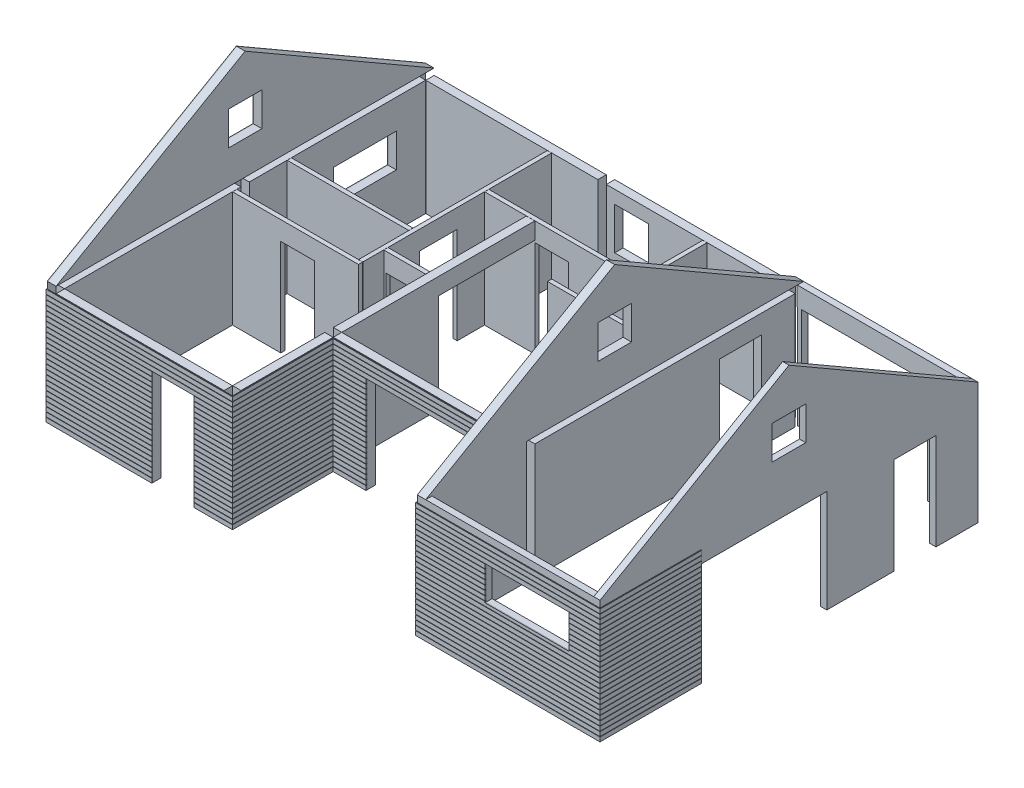
from build123d import *

# Parameters (mm, degrees)
SKETCH_1_W             = 200
SKETCH_1_H             = 797
EXTRUDE_3_DEPTH        = 2750
SKETCH_1_W_2           = 4097
SKETCH_1_H_2           = 200
EXTRUDE_3_2_DEPTH      = 2750
SKETCH_1_H_3           = 4200
EXTRUDE_3_3_DEPTH      = 2750
SKETCH_1_W_3           = 2297
EXTRUDE_3_4_DEPTH      = 2750
SKETCH_1_H_4           = 2194
EXTRUDE_3_5_DEPTH      = 2750
SKETCH_1_W_4           = 1200
EXTRUDE_3_6_DEPTH      = 2750
SKETCH_1_W_5           = 700
EXTRUDE_3_7_DEPTH      = 2750
SKETCH_1_W_6           = 1197
EXTRUDE_3_8_DEPTH      = 2750
SKETCH_1_H_5           = 4400
EXTRUDE_3_9_DEPTH      = 2750
SKETCH_1_H_6           = 2297
EXTRUDE_3_10_DEPTH     = 2750
EXTRUDE_3_11_DEPTH     = 2750
SKETCH_1_W_7           = 4300
EXTRUDE_3_12_DEPTH     = 2750
SKETCH_1_W_8           = 1051.560953437
SKETCH_1_H_7           = 100
EXTRUDE_3_13_DEPTH     = 2750
SKETCH_1_W_9           = 1145.439046563
EXTRUDE_3_14_DEPTH     = 2750
SKETCH_1_W_10          = 100
SKETCH_1_H_8           = 2247
EXTRUDE_3_15_DEPTH     = 2750
SKETCH_1_H_9           = 1347
EXTRUDE_3_16_DEPTH     = 2750
SKETCH_1_W_11          = 47
EXTRUDE_3_17_DEPTH     = 2750
SKETCH_1_W_12          = 2894
EXTRUDE_3_18_DEPTH     = 2750
SKETCH_1_W_13          = 1700
EXTRUDE_3_19_DEPTH     = 2750
SKETCH_1_W_14          = 2997
EXTRUDE_3_20_DEPTH     = 2750
SKETCH_1_H_10          = 1494
EXTRUDE_3_21_DEPTH     = 2750
EXTRUDE_3_22_DEPTH     = 2750
EXTRUDE_3_23_DEPTH     = 2750
SKETCH_2_W             = 1500
SKETCH_2_H             = 800
CUT_EXTRUDE_2_DEPTH    = 250
SKETCH_3_W             = 800
SKETCH_3_H             = 1000
CUT_EXTRUDE_3_DEPTH    = 593
SKETCH_4_W             = 933.030817478
SKETCH_4_H             = 100
SKETCH_4_W_2           = 947
SKETCH_4_W_3           = 100
SKETCH_4_H_2           = 1065.645919997
SKETCH_4_W_4           = 1106.288708332
SKETCH_4_W_5           = 2267.433140047
SKETCH_4_H_3           = 200
SKETCH_4_W_6           = 200
SKETCH_4_H_4           = 1253.150135291
SKETCH_4_W_7           = 1218.539312582
SKETCH_4_H_5           = 203
EXTRUDE_4_DEPTH        = 450
EXTRUDE_5_DEPTH        = 150
SKETCH_6_W             = 1000
SKETCH_6_H             = 2500
SKETCH_6_W_2           = 3000
SKETCH_6_H_2           = 2644.337567297
CUT_EXTRUDE_5_DEPTH    = 670
EXTRUDE_7_DEPTH        = 100
SKETCH_8_W             = 800
SKETCH_8_H             = 800
EXTRUDE_8_DEPTH        = 200
EXTRUDE_9_DEPTH        = 200
SKETCH_10_W            = 4000
SKETCH_10_H            = 150
SKETCH_10_W_2          = 900
SKETCH_10_W_3          = 100
EXTRUDE_10_DEPTH       = 3100
PATTERN_LINEAR_1_COUNT = 25
PATTERN_LINEAR_1_PITCH = 110
SKETCH_11_W            = 2397
SKETCH_11_H            = 2635.525513421
SKETCH_11_W_2          = 1000
SKETCH_11_H_2          = 2423.148146905
SKETCH_11_W_3          = 2000
SKETCH_11_H_3          = 800
CUT_EXTRUDE_6_DEPTH    = 5123
SKETCH_8_2_W           = 800
SKETCH_8_2_H           = 800
CUT_EXTRUDE_7_DEPTH    = 16606
SKETCH_13_W            = 800
SKETCH_13_H            = 800
SKETCH_13_W_2          = 1500
EXTRUDE_54769_DEPTH    = 10
SKETCH_14_W            = 4833.974306468
SKETCH_14_H            = 577.238350183
CUT_EXTRUDE_8_DEPTH    = 9961
SKETCH_16_W            = 150
SKETCH_16_H            = 455.662432703
EXTRUDE_16_DEPTH       = 4160
SKETCH_17_W            = 200
SKETCH_17_H            = 400
EXTRUDE_17_DEPTH       = 2297


with BuildPart() as part:
    # Эскиз1 → Бобышка-Вытянуть3 (new body)
    with BuildSketch(Plane(origin=(0, 0, 0), x_dir=(1, 0, 0), z_dir=(0, 1, 0))):
        with Locations((8900, -601.5)):
            Rectangle(SKETCH_1_W, SKETCH_1_H)
    extrude(amount=EXTRUDE_3_DEPTH)



with BuildPart() as body_2:
    # Эскиз1 → Extrude 3 2 (new body)
    with BuildSketch(Plane(origin=(0, 0, 0), x_dir=(1, 0, 0), z_dir=(0, 1, 0))):
        with Locations((2251.5, -100)):
            Rectangle(SKETCH_1_W_2, SKETCH_1_H_2)
    extrude(amount=EXTRUDE_3_2_DEPTH)


with BuildPart() as body_3:
    # Эскиз1 → Extrude 3 3 (new body)
    with BuildSketch(Plane(origin=(0, 0, 0), x_dir=(1, 0, 0), z_dir=(0, 1, 0))):
        with Locations((100, -2300)):
            Rectangle(SKETCH_1_W, SKETCH_1_H_3)
    extrude(amount=EXTRUDE_3_3_DEPTH)

    # Эскиз2 → Вырез-Вытянуть2 (cut)
    with BuildSketch(Plane.ZY):
        with Locations((1650, 1650)):
            Rectangle(SKETCH_2_W, SKETCH_2_H)
    extrude(amount=-CUT_EXTRUDE_2_DEPTH, mode=Mode.SUBTRACT)


with BuildPart() as body_4:
    # Эскиз1 → Extrude 3 4 (new body)
    with BuildSketch(Plane(origin=(0, 0, 0), x_dir=(1, 0, 0), z_dir=(0, 1, 0))):
        with Locations((1351.5, -8900)):
            Rectangle(SKETCH_1_W_3, SKETCH_1_H_2)
    extrude(amount=EXTRUDE_3_4_DEPTH)


with BuildPart() as body_5:
    # Эскиз1 → Extrude 3 5 (new body)
    with BuildSketch(Plane(origin=(0, 0, 0), x_dir=(1, 0, 0), z_dir=(0, 1, 0))):
        with Locations((4300, -7700)):
            Rectangle(SKETCH_1_W, SKETCH_1_H_4)
    extrude(amount=EXTRUDE_3_5_DEPTH)


with BuildPart() as body_6:
    # Эскиз1 → Extrude 3 6 (new body)
    with BuildSketch(Plane(origin=(0, 0, 0), x_dir=(1, 0, 0), z_dir=(0, 1, 0))):
        with Locations((8197, -6500)):
            Rectangle(SKETCH_1_W_4, SKETCH_1_H_2)
    extrude(amount=EXTRUDE_3_6_DEPTH)


with BuildPart() as body_7:
    # Эскиз1 → Extrude 3 7 (new body)
    with BuildSketch(Plane(origin=(0, 0, 0), x_dir=(1, 0, 0), z_dir=(0, 1, 0))):
        with Locations((3850, -8900)):
            Rectangle(SKETCH_1_W_5, SKETCH_1_H_2)
    extrude(amount=EXTRUDE_3_7_DEPTH)


with BuildPart() as body_8:
    # Эскиз1 → Extrude 3 8 (new body)
    with BuildSketch(Plane(origin=(0, 0, 0), x_dir=(1, 0, 0), z_dir=(0, 1, 0))):
        with Locations((4998.5, -6500)):
            Rectangle(SKETCH_1_W_6, SKETCH_1_H_2)
    extrude(amount=EXTRUDE_3_8_DEPTH)


with BuildPart() as body_9:
    # Эскиз1 → Extrude 3 9 (new body)
    with BuildSketch(Plane(origin=(0, 0, 0), x_dir=(1, 0, 0), z_dir=(0, 1, 0))):
        with Locations((8900, -4200)):
            Rectangle(SKETCH_1_W, SKETCH_1_H_5)
    extrude(amount=EXTRUDE_3_9_DEPTH)


with BuildPart() as body_10:
    # Эскиз1 → Extrude 3 10 (new body)
    with BuildSketch(Plane(origin=(0, 0, 0), x_dir=(1, 0, 0), z_dir=(0, 1, 0))):
        with Locations((4300, -5248.5)):
            Rectangle(SKETCH_1_W, SKETCH_1_H_6)
    extrude(amount=EXTRUDE_3_10_DEPTH)

    # Эскиз17 → Бобышка-Вытянуть17 (add)
    with BuildSketch(Plane(origin=(0, 0, 4100), x_dir=(-1, 0, 0), z_dir=(0, 0, -1))):
        with Locations((-4300, 2550)):
            Rectangle(SKETCH_17_W, SKETCH_17_H)
    extrude(amount=EXTRUDE_17_DEPTH)


with BuildPart() as body_11:
    # Эскиз1 → Extrude 3 11 (new body)
    with BuildSketch(Plane(origin=(0, 0, 0), x_dir=(1, 0, 0), z_dir=(0, 1, 0))):
        with Locations((100, -6700)):
            Rectangle(SKETCH_1_W, SKETCH_1_H_3)
    extrude(amount=EXTRUDE_3_11_DEPTH)


with BuildPart() as body_12:
    # Эскиз1 → Extrude 3 12 (new body)
    with BuildSketch(Plane(origin=(0, 0, 0), x_dir=(1, 0, 0), z_dir=(0, 1, 0))):
        with Locations((6650, -100)):
            Rectangle(SKETCH_1_W_7, SKETCH_1_H_2)
    extrude(amount=EXTRUDE_3_12_DEPTH)

    # Эскиз3 → Вырез-Вытянуть3 (cut)
    with BuildSketch(Plane(origin=(0, 0, 0), x_dir=(-1, 0, 0), z_dir=(0, 0, -1))):
        with Locations((-5100, 1940)):
            Rectangle(SKETCH_3_W, SKETCH_3_H)
    extrude(amount=-CUT_EXTRUDE_3_DEPTH, mode=Mode.SUBTRACT)


with BuildPart() as body_13:
    # Эскиз1 → Extrude 3 13 (new body)
    with BuildSketch(Plane(origin=(0, 0, 0), x_dir=(1, 0, 0), z_dir=(0, 1, 0))):
        with Locations((2674.219523282, -4750)):
            Rectangle(SKETCH_1_W_8, SKETCH_1_H_7)
    extrude(amount=EXTRUDE_3_13_DEPTH)


with BuildPart() as body_14:
    # Эскиз1 → Extrude 3 14 (new body)
    with BuildSketch(Plane(origin=(0, 0, 0), x_dir=(1, 0, 0), z_dir=(0, 1, 0))):
        with Locations((775.719523282, -4750)):
            Rectangle(SKETCH_1_W_9, SKETCH_1_H_7)
    extrude(amount=EXTRUDE_3_14_DEPTH)


with BuildPart() as body_15:
    # Эскиз1 → Extrude 3 15 (new body)
    with BuildSketch(Plane(origin=(0, 0, 0), x_dir=(1, 0, 0), z_dir=(0, 1, 0))):
        with Locations((3150, -1326.5)):
            Rectangle(SKETCH_1_W_10, SKETCH_1_H_8)
    extrude(amount=EXTRUDE_3_15_DEPTH)


with BuildPart() as body_16:
    # Эскиз1 → Extrude 3 16 (new body)
    with BuildSketch(Plane(origin=(0, 0, 0), x_dir=(1, 0, 0), z_dir=(0, 1, 0))):
        with Locations((3150, -4023.5)):
            Rectangle(SKETCH_1_W_10, SKETCH_1_H_9)
    extrude(amount=EXTRUDE_3_16_DEPTH)


with BuildPart() as body_17:
    # Эскиз1 → Extrude 3 17 (new body)
    with BuildSketch(Plane(origin=(0, 0, 0), x_dir=(1, 0, 0), z_dir=(0, 1, 0))):
        with Locations((4173.5, -4150)):
            Rectangle(SKETCH_1_W_11, SKETCH_1_H_7)
    extrude(amount=EXTRUDE_3_17_DEPTH)


with BuildPart() as body_18:
    # Эскиз1 → Extrude 3 18 (new body)
    with BuildSketch(Plane(origin=(0, 0, 0), x_dir=(1, 0, 0), z_dir=(0, 1, 0))):
        with Locations((1650, -3450)):
            Rectangle(SKETCH_1_W_12, SKETCH_1_H_7)
    extrude(amount=EXTRUDE_3_18_DEPTH)


with BuildPart() as body_19:
    # Эскиз1 → Extrude 3 19 (new body)
    with BuildSketch(Plane(origin=(0, 0, 0), x_dir=(1, 0, 0), z_dir=(0, 1, 0))):
        with Locations((6050, -1750)):
            Rectangle(SKETCH_1_W_13, SKETCH_1_H_7)
    extrude(amount=EXTRUDE_3_19_DEPTH)


with BuildPart() as body_20:
    # Эскиз1 → Extrude 3 20 (new body)
    with BuildSketch(Plane(origin=(0, 0, 0), x_dir=(1, 0, 0), z_dir=(0, 1, 0))):
        with Locations((7298.5, -2850)):
            Rectangle(SKETCH_1_W_14, SKETCH_1_H_7)
    extrude(amount=EXTRUDE_3_20_DEPTH)


with BuildPart() as body_21:
    # Эскиз1 → Extrude 3 21 (new body)
    with BuildSketch(Plane(origin=(0, 0, 0), x_dir=(1, 0, 0), z_dir=(0, 1, 0))):
        with Locations((6850, -950)):
            Rectangle(SKETCH_1_W_10, SKETCH_1_H_10)
    extrude(amount=EXTRUDE_3_21_DEPTH)


with BuildPart() as body_22:
    # Эскиз1 → Extrude 3 22 (new body)
    with BuildSketch(Plane(origin=(0, 0, 0), x_dir=(1, 0, 0), z_dir=(0, 1, 0))):
        with Locations((3801.5, -1750)):
            Rectangle(SKETCH_1_W_6, SKETCH_1_H_7)
    extrude(amount=EXTRUDE_3_22_DEPTH)


with BuildPart() as body_23:
    # Эскиз1 → Extrude 3 23 (new body)
    with BuildSketch(Plane(origin=(0, 0, 0), x_dir=(1, 0, 0), z_dir=(0, 1, 0))):
        with Locations((3226.5, -4150)):
            Rectangle(SKETCH_1_W_11, SKETCH_1_H_7)
    extrude(amount=EXTRUDE_3_23_DEPTH)


with BuildPart() as part_1:
    add(part.part)

    add(body_4.part)  # Бобышка-Вытянуть4 merges body 4

    add(body_6.part)  # Бобышка-Вытянуть4 merges body 6

    add(body_7.part)  # Бобышка-Вытянуть4 merges body 7

    add(body_8.part)  # Бобышка-Вытянуть4 merges body 8

    add(body_9.part)  # Бобышка-Вытянуть4 merges body 9

    add(body_13.part)  # Бобышка-Вытянуть4 merges body 13

    add(body_14.part)  # Бобышка-Вытянуть4 merges body 14

    add(body_15.part)  # Бобышка-Вытянуть4 merges body 15

    add(body_16.part)  # Бобышка-Вытянуть4 merges body 16

    add(body_17.part)  # Бобышка-Вытянуть4 merges body 17

    add(body_19.part)  # Бобышка-Вытянуть4 merges body 19

    add(body_22.part)  # Бобышка-Вытянуть4 merges body 22

    add(body_23.part)  # Бобышка-Вытянуть4 merges body 23
    # Эскиз4 → Бобышка-Вытянуть4 (add)
    with BuildSketch(Plane(origin=(0, 2750, 0), x_dir=(1, 0, 0), z_dir=(0, 1, 0))):
        with Locations((1765.152589037, -4750)):
            Rectangle(SKETCH_4_W, SKETCH_4_H)
        with Locations((3700, -4150)):
            Rectangle(SKETCH_4_W_2, SKETCH_4_H)
        with Locations((3150, -2862.337852944)):
            Rectangle(SKETCH_4_W_3, SKETCH_4_H_2)
        with Locations((4789.2288963, -1750)):
            Rectangle(SKETCH_4_W_4, SKETCH_4_H)
        with Locations((6556.719626978, -6500)):
            Rectangle(SKETCH_4_W_5, SKETCH_4_H_3)
        with Locations((8900, -1527.400889881)):
            Rectangle(SKETCH_4_W_6, SKETCH_4_H_4)
        with Locations((2988.285525283, -8898.5)):
            Rectangle(SKETCH_4_W_7, SKETCH_4_H_5)
    extrude(amount=-EXTRUDE_4_DEPTH)


with BuildPart() as body_11_2:
    # Эскиз5 → Бобышка-Вытянуть5 (new body)
    with BuildSketch(Plane(origin=(13000, 0, 0), x_dir=(0, 0, -1), z_dir=(1, 0, 0))):
        Polygon((-4500, 5498.076211353), (-9000, 2900), (-9000, -200), (0, -200), (0, 2900), align=None)
    extrude(amount=EXTRUDE_5_DEPTH)

    # Эскиз6 → Вырез-Вытянуть5 (cut)
    with BuildSketch(Plane(origin=(13000, 0, 0), x_dir=(0, 0, -1), z_dir=(1, 0, 0))):
        with Locations((-1500, 1050)):
            Rectangle(SKETCH_6_W, SKETCH_6_H)
        with Locations((-5100, 1122.168783649)):
            Rectangle(SKETCH_6_W_2, SKETCH_6_H_2)
    extrude(amount=CUT_EXTRUDE_5_DEPTH, mode=Mode.SUBTRACT)



with BuildPart() as body_12_2:
    # Эскиз7 → Бобышка-Вытянуть7 (new body)
    with BuildSketch(Plane(origin=(0, 0, 0), x_dir=(1, 0, 0), z_dir=(0, 1, 0))):
        Polygon((0, -4600), (0, -9000), (4400, -9000), (4400, -6603), (8800, -6600.066666667), (8800, -9000), (13150, -9000), (13150, -6600), (13170, -6600), (13170, -9020), (8780, -9020), (8780, -6620.080004444), (4420, -6622.986671111), (4420, -9020), (-20, -9020), (-20, -4600), align=None)
    extrude_7 = extrude(amount=EXTRUDE_7_DEPTH)


with BuildPart() as body_13_2:
    # Эскиз8 → Бобышка-Вытянуть8 (new body)
    with BuildSketch(Plane.ZY):
        Polygon((4500, 5498.076211353), (0, 2900), (9000, 2900), align=None)
        with Locations((4500, 4100)):
            Rectangle(SKETCH_8_W, SKETCH_8_H, mode=Mode.SUBTRACT)
    extrude(amount=-EXTRUDE_8_DEPTH)


with BuildPart() as body_14_2:
    # Эскиз9 → Бобышка-Вытянуть9 (new body)
    with BuildSketch(Plane(origin=(9000, 0, 0), x_dir=(0, 0, -1), z_dir=(1, 0, 0))):
        Polygon((-6600, -200), (-6600, 2900), (0, 2900), (-4500, 5498.076211353), (-9000, 2900), (-9000, -200), align=None)
    extrude(amount=-EXTRUDE_9_DEPTH)


with BuildPart() as body_11_2_1:
    add(body_11_2.part)

    add(body_14_2.part)  # Бобышка-Вытянуть10 merges body 14 2
    # Эскиз10 → Бобышка-Вытянуть10 (add)
    with BuildSketch(Plane.XZ.offset(200)):
        with Locations((11000, 8925)):
            Rectangle(SKETCH_10_W, SKETCH_10_H)
        with Locations((12550, 75)):
            Rectangle(SKETCH_10_W_2, SKETCH_10_H)
        with Locations((9050, 75)):
            Rectangle(SKETCH_10_W_3, SKETCH_10_H)
    extrude(amount=-EXTRUDE_10_DEPTH)


with BuildPart() as pattern_linear_1_1:
    # Линейный массив1: pattern copy
    add(extrude_7.moved(Location(Vector(0, 1, 0) * (1 * PATTERN_LINEAR_1_PITCH))))


with BuildPart() as pattern_linear_1_2:
    # Линейный массив1: pattern copy
    add(extrude_7.moved(Location(Vector(0, 1, 0) * (2 * PATTERN_LINEAR_1_PITCH))))


with BuildPart() as pattern_linear_1_3:
    # Линейный массив1: pattern copy
    add(extrude_7.moved(Location(Vector(0, 1, 0) * (3 * PATTERN_LINEAR_1_PITCH))))


with BuildPart() as pattern_linear_1_4:
    # Линейный массив1: pattern copy
    add(extrude_7.moved(Location(Vector(0, 1, 0) * (4 * PATTERN_LINEAR_1_PITCH))))


with BuildPart() as pattern_linear_1_5:
    # Линейный массив1: pattern copy
    add(extrude_7.moved(Location(Vector(0, 1, 0) * (5 * PATTERN_LINEAR_1_PITCH))))


with BuildPart() as pattern_linear_1_6:
    # Линейный массив1: pattern copy
    add(extrude_7.moved(Location(Vector(0, 1, 0) * (6 * PATTERN_LINEAR_1_PITCH))))


with BuildPart() as pattern_linear_1_7:
    # Линейный массив1: pattern copy
    add(extrude_7.moved(Location(Vector(0, 1, 0) * (7 * PATTERN_LINEAR_1_PITCH))))


with BuildPart() as pattern_linear_1_8:
    # Линейный массив1: pattern copy
    add(extrude_7.moved(Location(Vector(0, 1, 0) * (8 * PATTERN_LINEAR_1_PITCH))))


with BuildPart() as pattern_linear_1_9:
    # Линейный массив1: pattern copy
    add(extrude_7.moved(Location(Vector(0, 1, 0) * (9 * PATTERN_LINEAR_1_PITCH))))


with BuildPart() as pattern_linear_1_10:
    # Линейный массив1: pattern copy
    add(extrude_7.moved(Location(Vector(0, 1, 0) * (10 * PATTERN_LINEAR_1_PITCH))))


with BuildPart() as pattern_linear_1_11:
    # Линейный массив1: pattern copy
    add(extrude_7.moved(Location(Vector(0, 1, 0) * (11 * PATTERN_LINEAR_1_PITCH))))


with BuildPart() as pattern_linear_1_12:
    # Линейный массив1: pattern copy
    add(extrude_7.moved(Location(Vector(0, 1, 0) * (12 * PATTERN_LINEAR_1_PITCH))))


with BuildPart() as pattern_linear_1_13:
    # Линейный массив1: pattern copy
    add(extrude_7.moved(Location(Vector(0, 1, 0) * (13 * PATTERN_LINEAR_1_PITCH))))


with BuildPart() as pattern_linear_1_14:
    # Линейный массив1: pattern copy
    add(extrude_7.moved(Location(Vector(0, 1, 0) * (14 * PATTERN_LINEAR_1_PITCH))))


with BuildPart() as pattern_linear_1_15:
    # Линейный массив1: pattern copy
    add(extrude_7.moved(Location(Vector(0, 1, 0) * (15 * PATTERN_LINEAR_1_PITCH))))


with BuildPart() as pattern_linear_1_16:
    # Линейный массив1: pattern copy
    add(extrude_7.moved(Location(Vector(0, 1, 0) * (16 * PATTERN_LINEAR_1_PITCH))))


with BuildPart() as pattern_linear_1_17:
    # Линейный массив1: pattern copy
    add(extrude_7.moved(Location(Vector(0, 1, 0) * (17 * PATTERN_LINEAR_1_PITCH))))


with BuildPart() as pattern_linear_1_18:
    # Линейный массив1: pattern copy
    add(extrude_7.moved(Location(Vector(0, 1, 0) * (18 * PATTERN_LINEAR_1_PITCH))))


with BuildPart() as pattern_linear_1_19:
    # Линейный массив1: pattern copy
    add(extrude_7.moved(Location(Vector(0, 1, 0) * (19 * PATTERN_LINEAR_1_PITCH))))


with BuildPart() as pattern_linear_1_20:
    # Линейный массив1: pattern copy
    add(extrude_7.moved(Location(Vector(0, 1, 0) * (20 * PATTERN_LINEAR_1_PITCH))))


with BuildPart() as pattern_linear_1_21:
    # Линейный массив1: pattern copy
    add(extrude_7.moved(Location(Vector(0, 1, 0) * (21 * PATTERN_LINEAR_1_PITCH))))


with BuildPart() as pattern_linear_1_22:
    # Линейный массив1: pattern copy
    add(extrude_7.moved(Location(Vector(0, 1, 0) * (22 * PATTERN_LINEAR_1_PITCH))))


with BuildPart() as pattern_linear_1_23:
    # Линейный массив1: pattern copy
    add(extrude_7.moved(Location(Vector(0, 1, 0) * (23 * PATTERN_LINEAR_1_PITCH))))


with BuildPart() as pattern_linear_1_24:
    # Линейный массив1: pattern copy
    add(extrude_7.moved(Location(Vector(0, 1, 0) * (24 * PATTERN_LINEAR_1_PITCH))))


with BuildPart() as cut_extrude_6_tool:
    # Эскиз11 → Вырез-Вытянуть6 (new body)
    with BuildSketch(Plane(origin=(0, 0, 6400), x_dir=(-1, 0, 0), z_dir=(0, 0, -1))):
        with Locations((-6398.5, 982.237243289)):
            Rectangle(SKETCH_11_W, SKETCH_11_H)
        with Locations((-3000, 1088.425926548)):
            Rectangle(SKETCH_11_W_2, SKETCH_11_H_2)
        with Locations((-11431.097201215, 1900)):
            Rectangle(SKETCH_11_W_3, SKETCH_11_H_3)
    extrude(amount=-CUT_EXTRUDE_6_DEPTH)


with BuildPart() as part_2:
    add(part_1.part)

    # Вырез-Вытянуть6: cut by cut_extrude_6_tool
    add(cut_extrude_6_tool.part, mode=Mode.SUBTRACT)


with BuildPart() as body_11_2_2:
    add(body_11_2_1.part)

    # Вырез-Вытянуть6: cut by cut_extrude_6_tool
    add(cut_extrude_6_tool.part, mode=Mode.SUBTRACT)

    # Эскиз8<2> → Вырез-Вытянуть7 (cut)
    with BuildSketch(Plane.ZY):
        with Locations((4500, 4100)):
            Rectangle(SKETCH_8_2_W, SKETCH_8_2_H)
    extrude(amount=-CUT_EXTRUDE_7_DEPTH, mode=Mode.SUBTRACT)

    # Эскиз14 → Вырез-Вытянуть8 (cut)
    with BuildSketch(Plane(origin=(0, 0, 0), x_dir=(-1, 0, 0), z_dir=(0, 0, -1))):
        with Locations((-11087.166783867, -288.619175092)):
            Rectangle(SKETCH_14_W, SKETCH_14_H)
    extrude(amount=-CUT_EXTRUDE_8_DEPTH, mode=Mode.SUBTRACT)

    # Эскиз16 → Бобышка-Вытянуть16 (add)
    with BuildSketch(Plane(origin=(13150, 0, 0), x_dir=(0, 0, -1), z_dir=(1, 0, 0))):
        with Locations((-75, 2672.168783648)):
            Rectangle(SKETCH_16_W, SKETCH_16_H)
    extrude(amount=-EXTRUDE_16_DEPTH)


with BuildPart() as body_12_2_1:
    add(body_12_2.part)

    # Вырез-Вытянуть6: cut by cut_extrude_6_tool
    add(cut_extrude_6_tool.part, mode=Mode.SUBTRACT)


with BuildPart() as pattern_linear_1_1_1:
    add(pattern_linear_1_1.part)

    # Вырез-Вытянуть6: cut by cut_extrude_6_tool
    add(cut_extrude_6_tool.part, mode=Mode.SUBTRACT)


with BuildPart() as pattern_linear_1_2_1:
    add(pattern_linear_1_2.part)

    # Вырез-Вытянуть6: cut by cut_extrude_6_tool
    add(cut_extrude_6_tool.part, mode=Mode.SUBTRACT)


with BuildPart() as pattern_linear_1_3_1:
    add(pattern_linear_1_3.part)

    # Вырез-Вытянуть6: cut by cut_extrude_6_tool
    add(cut_extrude_6_tool.part, mode=Mode.SUBTRACT)


with BuildPart() as pattern_linear_1_4_1:
    add(pattern_linear_1_4.part)

    # Вырез-Вытянуть6: cut by cut_extrude_6_tool
    add(cut_extrude_6_tool.part, mode=Mode.SUBTRACT)


with BuildPart() as pattern_linear_1_5_1:
    add(pattern_linear_1_5.part)

    # Вырез-Вытянуть6: cut by cut_extrude_6_tool
    add(cut_extrude_6_tool.part, mode=Mode.SUBTRACT)


with BuildPart() as pattern_linear_1_6_1:
    add(pattern_linear_1_6.part)

    # Вырез-Вытянуть6: cut by cut_extrude_6_tool
    add(cut_extrude_6_tool.part, mode=Mode.SUBTRACT)


with BuildPart() as pattern_linear_1_7_1:
    add(pattern_linear_1_7.part)

    # Вырез-Вытянуть6: cut by cut_extrude_6_tool
    add(cut_extrude_6_tool.part, mode=Mode.SUBTRACT)


with BuildPart() as pattern_linear_1_8_1:
    add(pattern_linear_1_8.part)

    # Вырез-Вытянуть6: cut by cut_extrude_6_tool
    add(cut_extrude_6_tool.part, mode=Mode.SUBTRACT)


with BuildPart() as pattern_linear_1_9_1:
    add(pattern_linear_1_9.part)

    # Вырез-Вытянуть6: cut by cut_extrude_6_tool
    add(cut_extrude_6_tool.part, mode=Mode.SUBTRACT)


with BuildPart() as pattern_linear_1_10_1:
    add(pattern_linear_1_10.part)

    # Вырез-Вытянуть6: cut by cut_extrude_6_tool
    add(cut_extrude_6_tool.part, mode=Mode.SUBTRACT)


with BuildPart() as pattern_linear_1_11_1:
    add(pattern_linear_1_11.part)

    # Вырез-Вытянуть6: cut by cut_extrude_6_tool
    add(cut_extrude_6_tool.part, mode=Mode.SUBTRACT)


with BuildPart() as pattern_linear_1_12_1:
    add(pattern_linear_1_12.part)

    # Вырез-Вытянуть6: cut by cut_extrude_6_tool
    add(cut_extrude_6_tool.part, mode=Mode.SUBTRACT)


with BuildPart() as pattern_linear_1_13_1:
    add(pattern_linear_1_13.part)

    # Вырез-Вытянуть6: cut by cut_extrude_6_tool
    add(cut_extrude_6_tool.part, mode=Mode.SUBTRACT)


with BuildPart() as pattern_linear_1_14_1:
    add(pattern_linear_1_14.part)

    # Вырез-Вытянуть6: cut by cut_extrude_6_tool
    add(cut_extrude_6_tool.part, mode=Mode.SUBTRACT)


with BuildPart() as pattern_linear_1_15_1:
    add(pattern_linear_1_15.part)

    # Вырез-Вытянуть6: cut by cut_extrude_6_tool
    add(cut_extrude_6_tool.part, mode=Mode.SUBTRACT)


with BuildPart() as pattern_linear_1_16_1:
    add(pattern_linear_1_16.part)

    # Вырез-Вытянуть6: cut by cut_extrude_6_tool
    add(cut_extrude_6_tool.part, mode=Mode.SUBTRACT)


with BuildPart() as pattern_linear_1_17_1:
    add(pattern_linear_1_17.part)

    # Вырез-Вытянуть6: cut by cut_extrude_6_tool
    add(cut_extrude_6_tool.part, mode=Mode.SUBTRACT)


with BuildPart() as pattern_linear_1_18_1:
    add(pattern_linear_1_18.part)

    # Вырез-Вытянуть6: cut by cut_extrude_6_tool
    add(cut_extrude_6_tool.part, mode=Mode.SUBTRACT)


with BuildPart() as pattern_linear_1_19_1:
    add(pattern_linear_1_19.part)

    # Вырез-Вытянуть6: cut by cut_extrude_6_tool
    add(cut_extrude_6_tool.part, mode=Mode.SUBTRACT)


with BuildPart() as pattern_linear_1_20_1:
    add(pattern_linear_1_20.part)

    # Вырез-Вытянуть6: cut by cut_extrude_6_tool
    add(cut_extrude_6_tool.part, mode=Mode.SUBTRACT)


with BuildPart() as body_38:
    # Эскиз13 → Extrude 54769 (new body)
    with BuildSketch(Plane.ZY):
        Polygon((4500, 5498.076211353), (0, 2900), (0, 0), (9000, 0), (9000, 2900), align=None)
        with Locations((4500, 4100)):
            Rectangle(SKETCH_13_W, SKETCH_13_H, mode=Mode.SUBTRACT)
        with Locations((1650, 1650)):
            Rectangle(SKETCH_13_W_2, SKETCH_13_H, mode=Mode.SUBTRACT)
    extrude(amount=EXTRUDE_54769_DEPTH)


solid = Compound([body_2.part, body_3.part, body_5.part, body_10.part, body_11.part, body_12.part, body_18.part, body_20.part, body_21.part, body_13_2.part, pattern_linear_1_21.part, pattern_linear_1_22.part, pattern_linear_1_23.part, pattern_linear_1_24.part, part_2.part, body_11_2_2.part, body_12_2_1.part, pattern_linear_1_1_1.part, pattern_linear_1_2_1.part, pattern_linear_1_3_1.part, pattern_linear_1_4_1.part, pattern_linear_1_5_1.part, pattern_linear_1_6_1.part, pattern_linear_1_7_1.part, pattern_linear_1_8_1.part, pattern_linear_1_9_1.part, pattern_linear_1_10_1.part, pattern_linear_1_11_1.part, pattern_linear_1_12_1.part, pattern_linear_1_13_1.part, pattern_linear_1_14_1.part, pattern_linear_1_15_1.part, pattern_linear_1_16_1.part, pattern_linear_1_17_1.part, pattern_linear_1_18_1.part, pattern_linear_1_19_1.part, pattern_linear_1_20_1.part, body_38.part])
